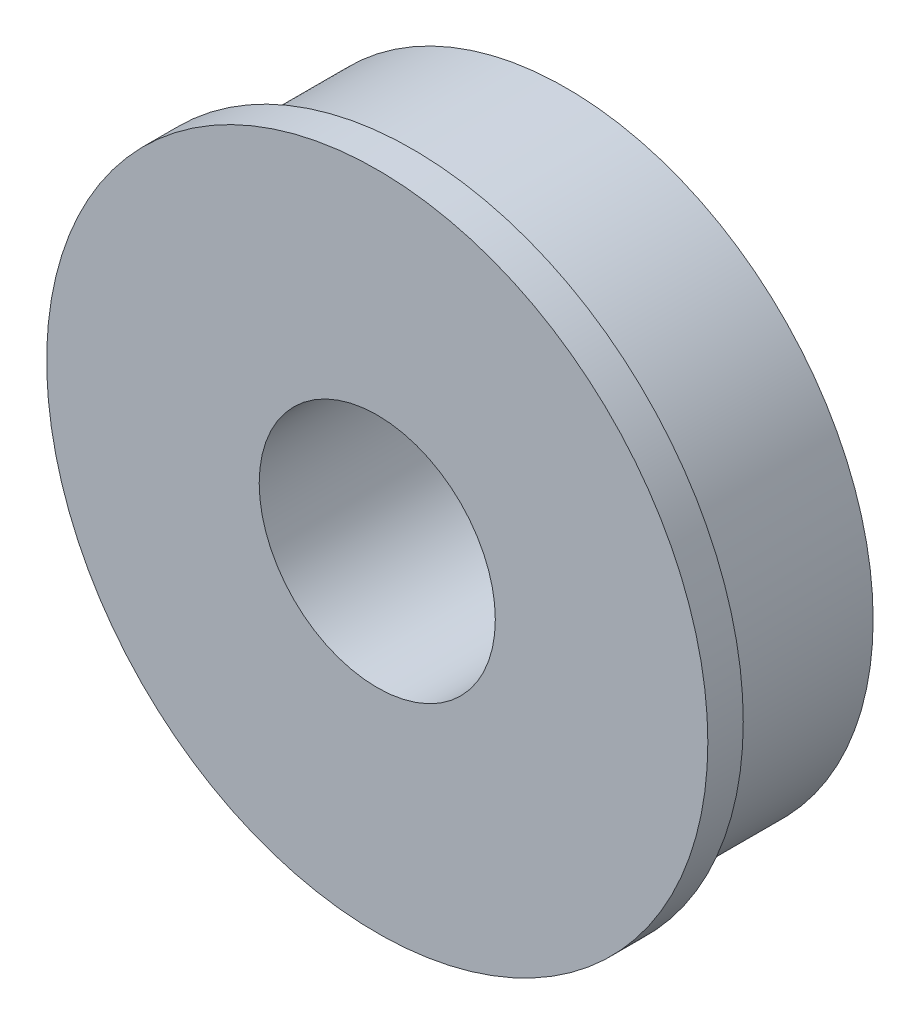
from build123d import *

# Parameters (mm, degrees)
SKETCH_2_R      = 13
SKETCH_2_R_2    = 5
EXTRUDE_1_DEPTH = 8
EXTRUDE_START   = -1.5
SKETCH_3_R      = 14
SKETCH_3_R_2    = 5
EXTRUDE_2_DEPTH = 1.5


with BuildPart() as part:
    # 草图2 → 凸台-拉伸1 (new body)
    with BuildSketch(Plane.XY):
        Circle(SKETCH_2_R)
        Circle(SKETCH_2_R_2, mode=Mode.SUBTRACT)
    extrude(amount=EXTRUDE_1_DEPTH)

    # 草图3 → 凸台-拉伸2 (add)
    with BuildSketch(Plane.XY.offset(8).offset(EXTRUDE_START)):
        Circle(SKETCH_3_R)
        Circle(SKETCH_3_R_2, mode=Mode.SUBTRACT)
    extrude(amount=EXTRUDE_2_DEPTH)


solid = part.part
